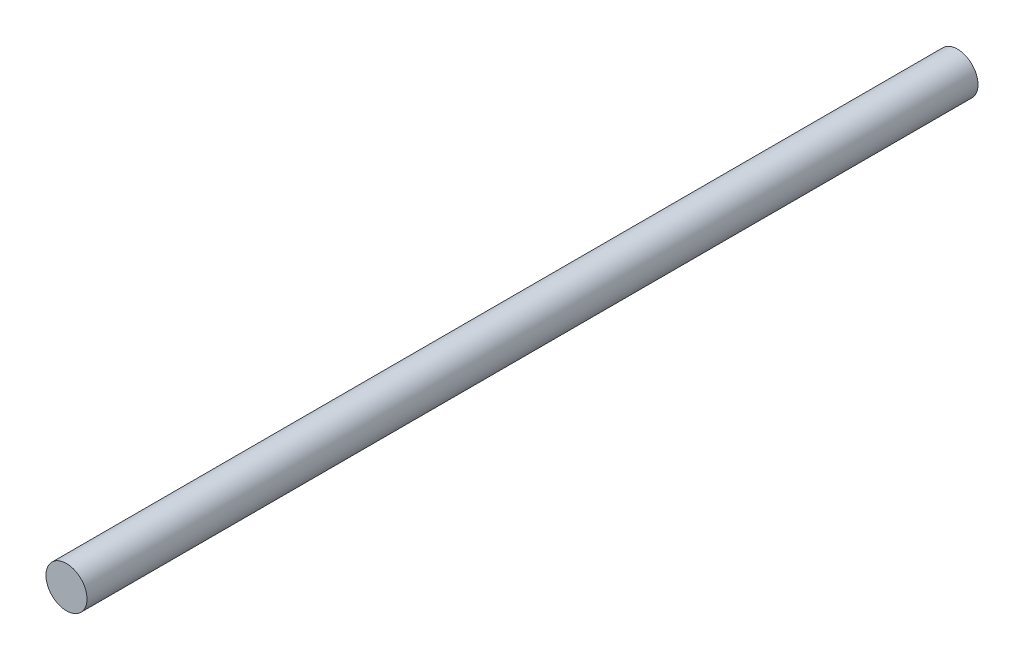
from build123d import *

# Parameters (mm, degrees)
SKETCH_1_R      = 2.89512778
EXTRUDE_1_DEPTH = 125.7


with BuildPart() as part:
    # 草图1 → 凸台-拉伸1 (new body)
    with BuildSketch(Plane.XY):
        with Locations((20.000000954, 6.999999815)):
            Circle(SKETCH_1_R)
    extrude(amount=EXTRUDE_1_DEPTH)


solid = part.part
